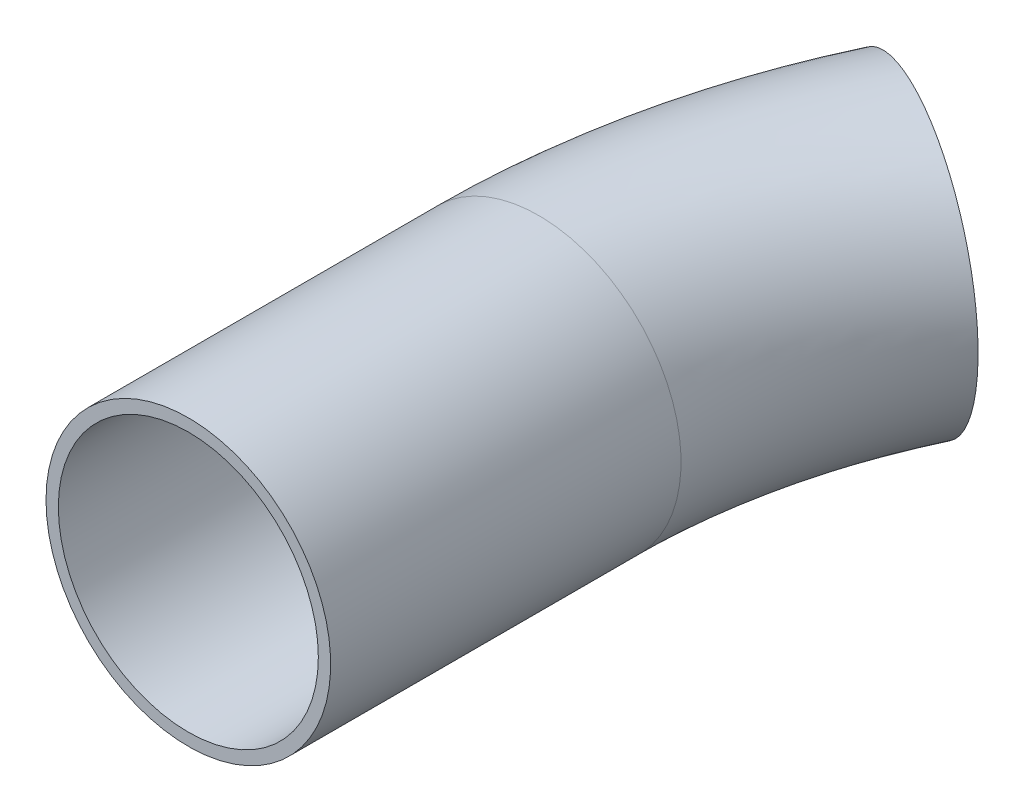
from build123d import *

# Parameters (mm, degrees)
SKETCH2_R   = 19.05
SKETCH2_R_2 = 17.399


with BuildPart() as part:
    # Sweep1: sweep along a path in Sketch1
    with BuildLine(Plane(origin=(0, 0, 0), x_dir=(1, 0, 0), z_dir=(0, 1, 0))) as sweep1_path:
        Line((0, 25.4), (0, 72.291460583))
        ThreePointArc((0, 72.291460583), (2.286651426, 93.086876486), (9.037334662, 112.888552505))
    # Sketch2 → Sweep1 (sweep)
    with BuildSketch(Plane(origin=(0, 0, -25.4), x_dir=(-1, 0, 0), z_dir=(0, 0, -1))):
        Circle(SKETCH2_R)
        Circle(SKETCH2_R_2, mode=Mode.SUBTRACT)
    sweep(path=sweep1_path.line)


solid = part.part
